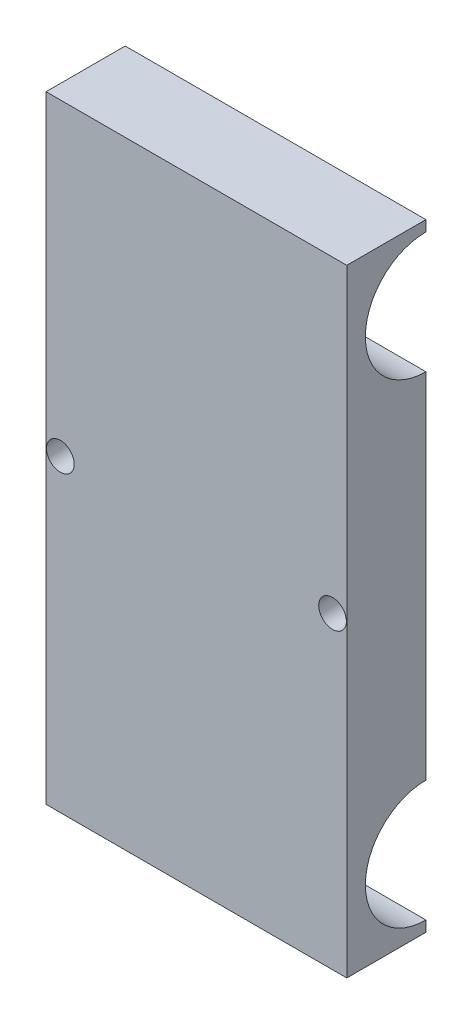
from build123d import *

# Parameters (mm, degrees)
SKETCH1_W           = 38
SKETCH1_H           = 78
BOSS_EXTRUDE1_DEPTH = 10
SKETCH2_R           = 7.65
CUT_EXTRUDE1_DEPTH  = 88.338422244
SKETCH3_R           = 1.75
CUT_EXTRUDE2_DEPTH  = 88.338422244


with BuildPart() as part:
    # Sketch1 → Boss-Extrude1 (new body)
    with BuildSketch(Plane.XY):
        with Locations((19, 39)):
            Rectangle(SKETCH1_W, SKETCH1_H)
    extrude(amount=BOSS_EXTRUDE1_DEPTH)

    # Sketch2 → Cut-Extrude1 (cut, through all)
    with BuildSketch(Plane.ZY):
        with Locations((0, 69)):
            Circle(SKETCH2_R)
        with Locations((0, 9)):
            Circle(SKETCH2_R)
    extrude(amount=-CUT_EXTRUDE1_DEPTH, mode=Mode.SUBTRACT)

    # Sketch3 → Cut-Extrude2 (cut, through all)
    with BuildSketch(Plane(origin=(0, 0, 0), x_dir=(-1, 0, 0), z_dir=(0, 0, -1))):
        with Locations((-36.2, 39)):
            Circle(SKETCH3_R)
        with Locations((-1.8, 39)):
            Circle(SKETCH3_R)
    extrude(amount=-CUT_EXTRUDE2_DEPTH, mode=Mode.SUBTRACT)


solid = part.part
